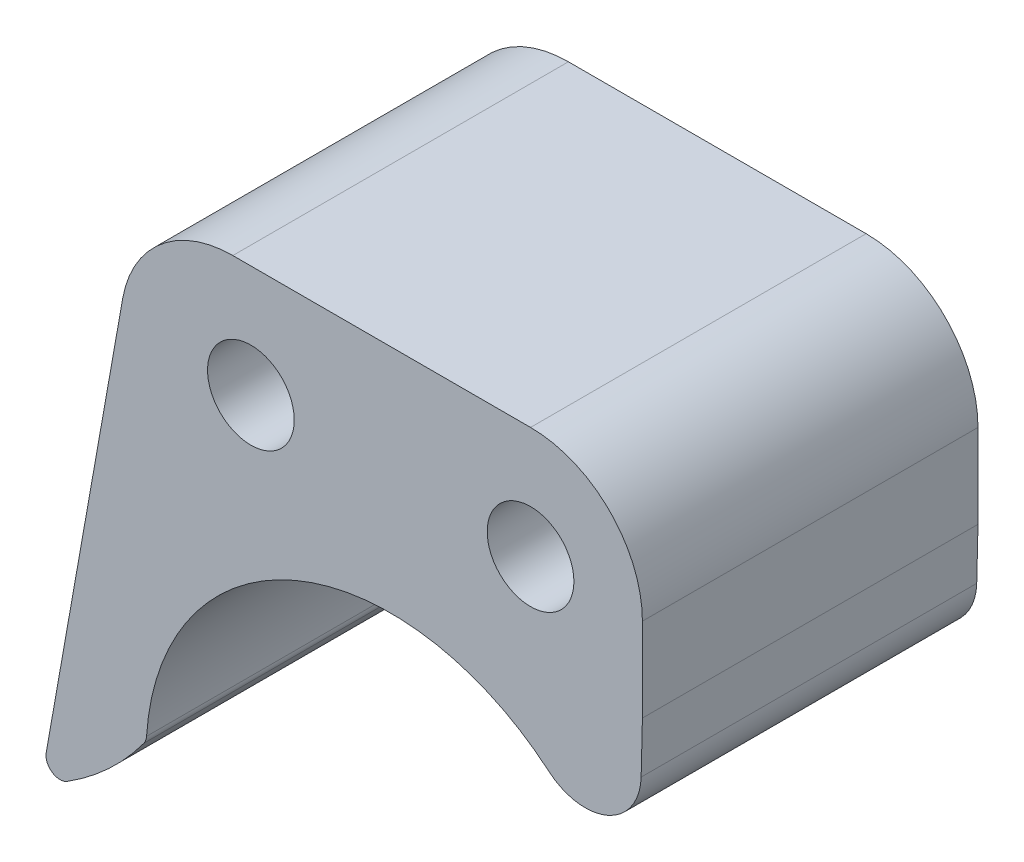
from build123d import *

# Parameters (mm, degrees)
SKETCH_1_R      = 1.5499999999999998
SKETCH_1_R_2    = 1.5499999999999994
EXTRUDE_1_DEPTH = 12
EXTRUDE_2_DEPTH = 12
FILLET_1_R      = 0.5
FILLET_2_R      = 4
FILLET_3_R      = 2


with BuildPart() as part:
    # 草图1 → 凸台-拉伸1 (new body)
    with BuildSketch(Plane.XY):
        Polygon((14.000000000000002, -2.9999999999999982), (-4.000000000000002, -3.0000000000000004), (-4.000000000000002, 4), (14.000000000000002, 4.000000000000002), align=None)
        Circle(SKETCH_1_R, mode=Mode.SUBTRACT)
        with Locations((10, 0)):
            Circle(SKETCH_1_R_2, mode=Mode.SUBTRACT)
    extrude(amount=EXTRUDE_1_DEPTH)

    # 草图2 → 凸台-拉伸2 (add)
    with BuildSketch(Plane.XY.offset(12)):
        with BuildLine():
            Line((-4.000000000000002, 4), (-4.000000000000002, -3.0000000000000004))
            Line((-4.000000000000002, -3.0000000000000004), (14.000000000000002, -2.9999999999999982))
            Line((14.000000000000002, -2.9999999999999982), (13.747325070832083, -13.216342563780504))
            ThreePointArc((13.747325070832083, -13.216342563780504), (5.32150522875723, -4.255908601356449), (-3.7395934787153213, -12.573378590451934))
            ThreePointArc((-3.7395934787153213, -12.573378590451934), (-5.421370715664583, -14.406478038174821), (-7.50358636440358, -15.767729760711498))
            Line((-7.50358636440358, -15.767729760711498), (-4.000000000000002, 4))
        make_face()
    extrude(amount=-EXTRUDE_2_DEPTH)

    # 圆角1
    fillet_1_edges = [part.edges().sort_by_distance(p)[0] for p in [
        (-7.50358636440358, -15.7677297607115, 6),
        (-3.7395934787153218, -12.573378590451934, 6),
    ]]
    fillet(fillet_1_edges, radius=FILLET_1_R)

    # 圆角2
    fillet_2_edges = [part.edges().sort_by_distance(p)[0] for p in [
        (-4.000000000000002, 4, 6),
        (14.000000000000002, 4.000000000000002, 6),
    ]]
    fillet(fillet_2_edges, radius=FILLET_2_R)

    # 圆角3
    fillet_3_edges = [part.edges().sort_by_distance(p)[0] for p in [
        (13.747325070832083, -13.216342563780504, 6),
    ]]
    fillet(fillet_3_edges, radius=FILLET_3_R)


solid = part.part
